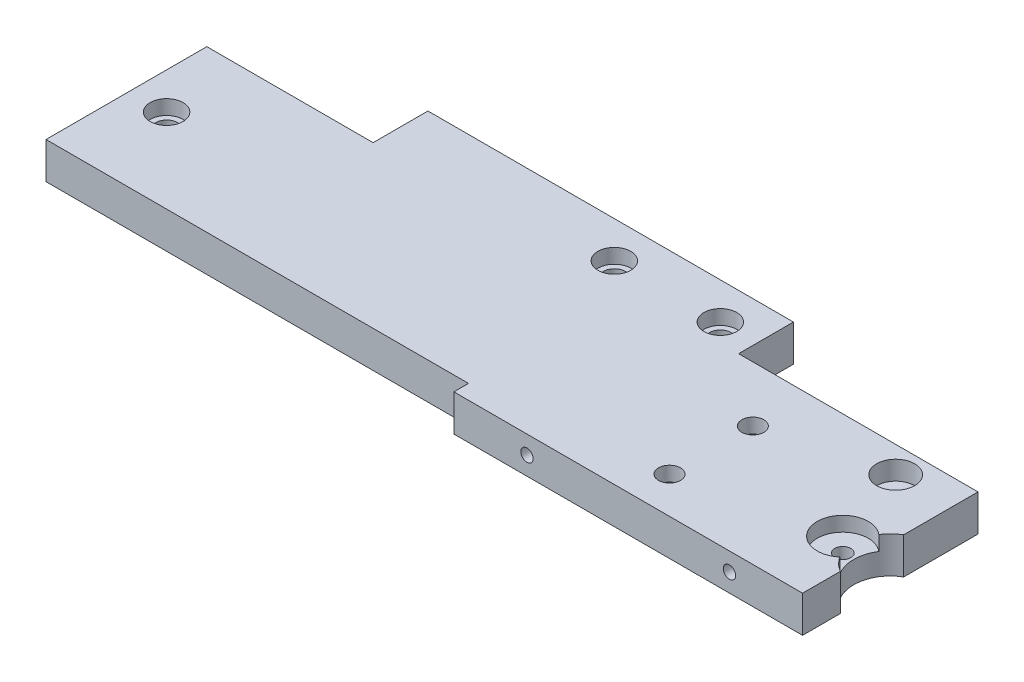
from build123d import *

# Parameters (mm, degrees)
EXTRUDE_1_DEPTH      = 5
SKETCH_1_20_R        = 1.5
CUT_EXTRUDE_2_DEPTH  = 79.662649968
CUT_EXTRUDE_START    = 5
SKETCH_1_22_R        = 2.25
CUT_EXTRUDE_3_DEPTH  = 2
SKETCH_1_23_R        = 2.6
CUT_EXTRUDE_4_DEPTH  = 2.6
SKETCH_1_24_R        = 1.1
CUT_EXTRUDE_6_DEPTH  = 84.662649968
SKETCH_4_R           = 1.5
CUT_EXTRUDE_7_DEPTH  = 79.662649968
SKETCH_4_3_R         = 2.25
CUT_EXTRUDE_8_DEPTH  = 3
SKETCH_5_W           = 47.701964887
SKETCH_5_H           = 5
EXTRUDE_2_DEPTH      = 2
SKETCH_6_R           = 0.85
CUT_EXTRUDE_9_DEPTH  = 4
SKETCH_1_25_R        = 5
CUT_EXTRUDE_12_DEPTH = 80.434328221
SKETCH_1_26_R        = 3.5
CUT_EXTRUDE_13_DEPTH = 2


with BuildPart() as part:
    # 草图1 → 凸台-拉伸1 (new body)
    with BuildSketch(Plane(origin=(0, 0, 0), x_dir=(1, 0, 0), z_dir=(0, 1, 0))):
        Polygon((-72.75, -7.5), (-72.75, -29.5), (32.75, -29.5), (32.75, -7.5), (0, -7.5), (0, 0), (-50, 0), (-50, -7.5), align=None)
    extrude(amount=EXTRUDE_1_DEPTH)

    # 草图1<20> → 切除-拉伸2 (cut, through all)
    with BuildSketch(Plane(origin=(0, 0, 0), x_dir=(1, 0, 0), z_dir=(0, 1, 0))):
        with Locations(Location((-19.5, -5, 0), (0, 0, 270))):
            Circle(SKETCH_1_20_R)
        with Locations(Location((-5, -5, 0), (0, 0, 270))):
            Circle(SKETCH_1_20_R)
        with Locations(Location((-67.75, -18, 0), (0, 0, 270))):
            Circle(SKETCH_1_20_R)
    extrude(amount=CUT_EXTRUDE_2_DEPTH, mode=Mode.SUBTRACT)

    # 草图1<22> → 切除-拉伸3 (cut)
    with BuildSketch(Plane(origin=(0, 0, 0), x_dir=(1, 0, 0), z_dir=(0, 1, 0)).offset(CUT_EXTRUDE_START)):
        with Locations(Location((-19.5, -5, 0), (0, 0, 270))):
            Circle(SKETCH_1_22_R)
        with Locations(Location((-5, -5, 0), (0, 0, 270))):
            Circle(SKETCH_1_22_R)
        with Locations(Location((-67.75, -18, 0), (0, 0, 270))):
            Circle(SKETCH_1_22_R)
    extrude(amount=-CUT_EXTRUDE_3_DEPTH, mode=Mode.SUBTRACT)

    # 草图1<23> → 切除-拉伸4 (cut)
    with BuildSketch(Plane(origin=(0, 0, 0), x_dir=(1, 0, 0), z_dir=(0, 1, 0)).offset(CUT_EXTRUDE_START)):
        with Locations(Location((25.083939444, -11.1, 0), (0, 0, 270))):
            Circle(SKETCH_1_23_R)
    extrude(amount=-CUT_EXTRUDE_4_DEPTH, mode=Mode.SUBTRACT)

    # 草图1<24> → 切除-拉伸6 (cut, through all)
    with BuildSketch(Plane(origin=(0, 0, 0), x_dir=(1, 0, 0), z_dir=(0, 1, 0)).offset(CUT_EXTRUDE_START)):
        with Locations(Location((28.75, -22, 0), (0, 0, 270))):
            Circle(SKETCH_1_24_R)
        with Locations(Location((25.083939444, -11.1, 0), (0, 0, 270))):
            Circle(SKETCH_1_24_R)
    extrude(amount=-CUT_EXTRUDE_6_DEPTH, mode=Mode.SUBTRACT)

    # 草图4 → 切除-拉伸7 (cut, through all)
    with BuildSketch(Plane.XZ):
        with Locations(Location((9.548035113, 15.1, 0), (0, 0, 270))):
            Circle(SKETCH_4_R)
        with Locations(Location((9.548035113, 26.5, 0), (0, 0, 270))):
            Circle(SKETCH_4_R)
    extrude(amount=-CUT_EXTRUDE_7_DEPTH, mode=Mode.SUBTRACT)

    # 草图4<3> → 切除-拉伸8 (cut)
    with BuildSketch(Plane.XZ):
        with Locations(Location((9.548035113, 15.1, 0), (0, 0, 270))):
            Circle(SKETCH_4_3_R)
        with Locations(Location((9.548035113, 26.5, 0), (0, 0, 270))):
            Circle(SKETCH_4_3_R)
    extrude(amount=-CUT_EXTRUDE_8_DEPTH, mode=Mode.SUBTRACT)

    # 草图5 → 凸台-拉伸2 (add)
    with BuildSketch(Plane.XY.offset(29.5)):
        with Locations((8.899017556, 2.5)):
            Rectangle(SKETCH_5_W, SKETCH_5_H)
    extrude(amount=EXTRUDE_2_DEPTH)

    # 草图6 → 切除-拉伸9 (cut)
    with BuildSketch(Plane.XY.offset(31.5)):
        with Locations((22.75, 2.5)):
            Circle(SKETCH_6_R)
        with Locations((-4.951964887, 2.5)):
            Circle(SKETCH_6_R)
    extrude(amount=-CUT_EXTRUDE_9_DEPTH, mode=Mode.SUBTRACT)

    # 草图1<25> → 切除-拉伸12 (cut, through all)
    with BuildSketch(Plane(origin=(0, 0, 0), x_dir=(1, 0, 0), z_dir=(0, 1, 0))):
        with Locations((35.25, -22)):
            Circle(SKETCH_1_25_R)
    extrude(amount=CUT_EXTRUDE_12_DEPTH, mode=Mode.SUBTRACT)

    # 草图1<26> → 切除-拉伸13 (cut)
    with BuildSketch(Plane(origin=(0, 0, 0), x_dir=(1, 0, 0), z_dir=(0, 1, 0)).offset(CUT_EXTRUDE_START)):
        with Locations((28.75, -22)):
            Circle(SKETCH_1_26_R)
    extrude(amount=-CUT_EXTRUDE_13_DEPTH, mode=Mode.SUBTRACT)


solid = part.part
